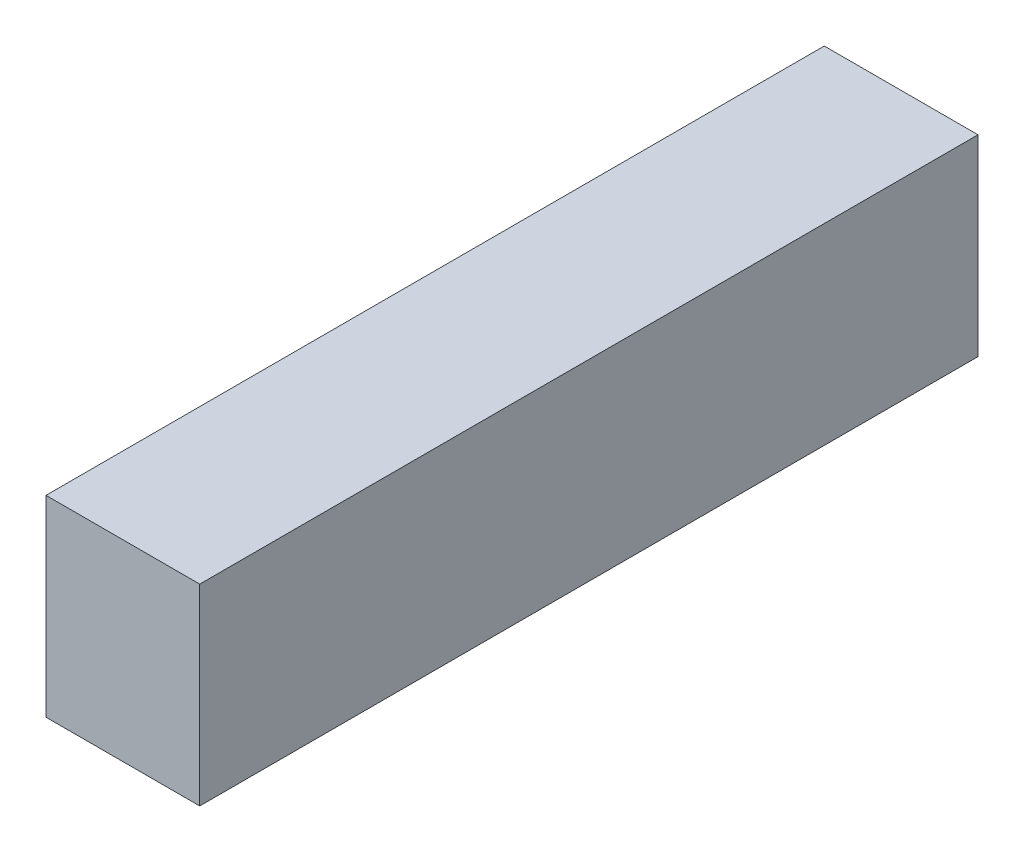
from build123d import *

# Parameters (mm, degrees)
SKETCH_1_W      = 320
SKETCH_1_H      = 1620
EXTRUDE_1_DEPTH = 400


with BuildPart() as part:
    # 草图1 → 凸台-拉伸1 (new body)
    with BuildSketch(Plane(origin=(0, 0, 0), x_dir=(1, 0, 0), z_dir=(0, 1, 0))):
        Rectangle(SKETCH_1_W, SKETCH_1_H)
    extrude(amount=EXTRUDE_1_DEPTH)


solid = part.part
